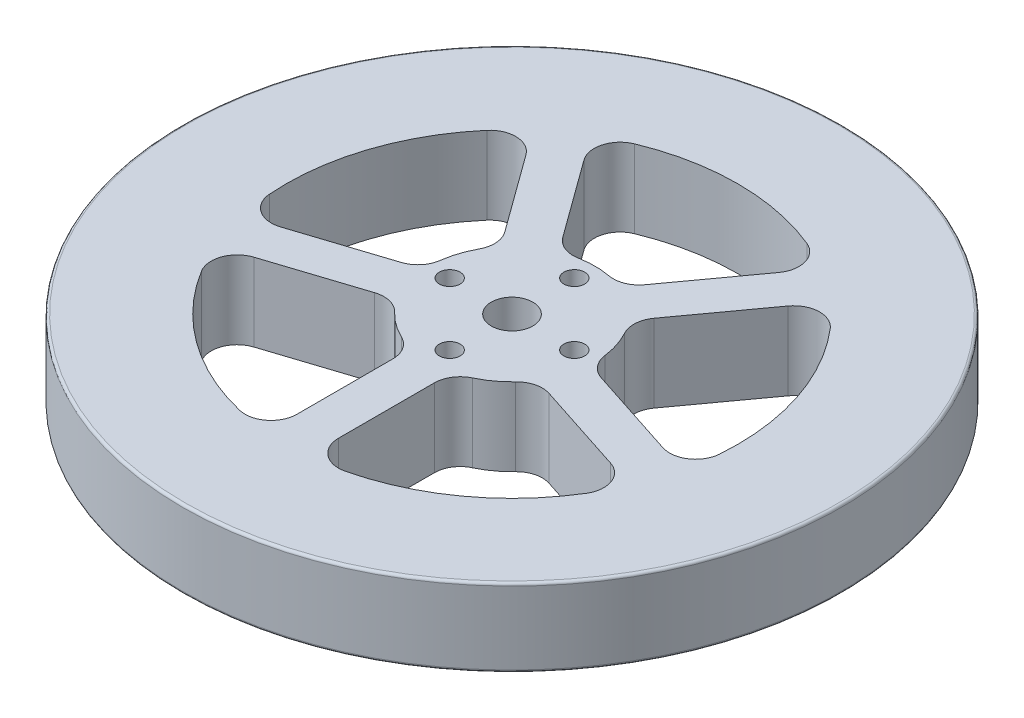
from build123d import *

# Parameters (mm, degrees)
SKETCH2_R           = 63.5
BOSS_EXTRUDE1_DEPTH = 15
FILLET2_R           = 0.5
CUT_EXTRUDE3_REACH  = 93.047
CUT_EXTRUDE4_REACH  = 93.047
SKETCH6_R           = 2
FILLET3_R           = 5
SKETCH6_4_R         = 2
SKETCH6_4_R_2       = 4
CUT_EXTRUDE5_DEPTH  = 92.046691388


with BuildPart() as part:
    # Sketch2 → Boss-Extrude1 (new body)
    with BuildSketch(Plane(origin=(0, 0, 0), x_dir=(1, 0, 0), z_dir=(0, 1, 0))):
        Circle(SKETCH2_R)
    extrude(amount=BOSS_EXTRUDE1_DEPTH)

    # Fillet2
    fillet2_edges = [part.edges().sort_by_distance(p)[0] for p in [
        (-63.5, 15, 0),
        (-63.5, 0, 0),
    ]]
    fillet(fillet2_edges, radius=FILLET2_R)

    # Sketch5 → Cut-Extrude3 (cut, up to next)
    with BuildSketch(Plane.XZ, mode=Mode.PRIVATE) as cut_extrude3_sk1:
        with BuildLine():
            ThreePointArc((-13.497636218, 8.591496757), (-9.404564037, 12.94427191), (-4, 15.491933385))
            Line((-4, 15.491933385), (-4, 43.315701541))
            ThreePointArc((-4, 43.315701541), (-25.568658475, 35.192239255), (-39.959612231, 17.189513965))
            Line((-39.959612231, 17.189513965), (-13.497636218, 8.591496757))
        make_face()
    cut_extrude3_tool1 = extrude(cut_extrude3_sk1.sketch, amount=-CUT_EXTRUDE3_REACH, mode=Mode.PRIVATE) & part.part
    # Sketch5 → Cut-Extrude3 (cut, up to next)
    with BuildSketch(Plane.XZ, mode=Mode.PRIVATE) as cut_extrude3_sk2:
        with BuildLine():
            Line((4, 43.315701541), (4, 15.491933385))
            ThreePointArc((4, 15.491933385), (9.404564037, 12.94427191), (13.497636218, 8.591496757))
            Line((13.497636218, 8.591496757), (39.959612231, 17.189513965))
            ThreePointArc((39.959612231, 17.189513965), (25.568658475, 35.192239255), (4, 43.315701541))
        make_face()
    cut_extrude3_tool2 = extrude(cut_extrude3_sk2.sketch, amount=-CUT_EXTRUDE3_REACH, mode=Mode.PRIVATE) & part.part
    # Sketch5 → Cut-Extrude3 (cut, up to next)
    with BuildSketch(Plane.XZ, mode=Mode.PRIVATE) as cut_extrude3_sk3:
        with BuildLine():
            Line((42.431748186, 9.581061834), (15.969772173, 0.983044626))
            ThreePointArc((15.969772173, 0.983044626), (15.216904261, -4.94427191), (12.341997951, -10.182096375))
            Line((12.341997951, -10.182096375), (28.696398536, -32.691997661))
            ThreePointArc((28.696398536, -32.691997661), (41.370958459, -13.442239255), (42.431748186, 9.581061834))
        make_face()
    cut_extrude3_tool3 = extrude(cut_extrude3_sk3.sketch, amount=-CUT_EXTRUDE3_REACH, mode=Mode.PRIVATE) & part.part
    # Sketch5 → Cut-Extrude3 (cut, up to next)
    with BuildSketch(Plane.XZ, mode=Mode.PRIVATE) as cut_extrude3_sk4:
        with BuildLine():
            Line((22.224262581, -37.394279679), (5.869861996, -14.884378393))
            ThreePointArc((5.869861996, -14.884378393), (0, -16), (-5.869861996, -14.884378393))
            Line((-5.869861996, -14.884378393), (-22.224262581, -37.394279679))
            ThreePointArc((-22.224262581, -37.394279679), (0, -43.5), (22.224262581, -37.394279679))
        make_face()
    cut_extrude3_tool4 = extrude(cut_extrude3_sk4.sketch, amount=-CUT_EXTRUDE3_REACH, mode=Mode.PRIVATE) & part.part
    # Sketch5 → Cut-Extrude3 (cut, up to next)
    with BuildSketch(Plane.XZ, mode=Mode.PRIVATE) as cut_extrude3_sk5:
        with BuildLine():
            Line((-28.696398536, -32.691997661), (-12.341997951, -10.182096375))
            ThreePointArc((-12.341997951, -10.182096375), (-15.216904261, -4.94427191), (-15.969772173, 0.983044626))
            Line((-15.969772173, 0.983044626), (-42.431748186, 9.581061834))
            ThreePointArc((-42.431748186, 9.581061834), (-41.370958459, -13.442239255), (-28.696398536, -32.691997661))
        make_face()
    cut_extrude3_tool5 = extrude(cut_extrude3_sk5.sketch, amount=-CUT_EXTRUDE3_REACH, mode=Mode.PRIVATE) & part.part
    add(cut_extrude3_tool1.solids().sort_by_distance((-18.272678, 0, 25.150183))[0], mode=Mode.SUBTRACT)
    add(cut_extrude3_tool2.solids().sort_by_distance((18.272678, 0, 25.150183))[0], mode=Mode.SUBTRACT)
    add(cut_extrude3_tool3.solids().sort_by_distance((29.565814, 0, -9.606515))[0], mode=Mode.SUBTRACT)
    add(cut_extrude3_tool4.solids().sort_by_distance((0, 0, -31.087336))[0], mode=Mode.SUBTRACT)
    add(cut_extrude3_tool5.solids().sort_by_distance((-29.565814, 0, -9.606515))[0], mode=Mode.SUBTRACT)

    # Sketch6 → Cut-Extrude4 (cut, up to next)
    with BuildSketch(Plane.XZ, mode=Mode.PRIVATE) as cut_extrude4_sk1:
        with Locations((12, 0)):
            Circle(SKETCH6_R)
    cut_extrude4_tool1 = extrude(cut_extrude4_sk1.sketch, amount=-CUT_EXTRUDE4_REACH, mode=Mode.PRIVATE) & part.part
    # Sketch6 → Cut-Extrude4 (cut, up to next)
    with BuildSketch(Plane.XZ, mode=Mode.PRIVATE) as cut_extrude4_sk2:
        with Locations((0, -12)):
            Circle(SKETCH6_R)
    cut_extrude4_tool2 = extrude(cut_extrude4_sk2.sketch, amount=-CUT_EXTRUDE4_REACH, mode=Mode.PRIVATE) & part.part
    # Sketch6 → Cut-Extrude4 (cut, up to next)
    with BuildSketch(Plane.XZ, mode=Mode.PRIVATE) as cut_extrude4_sk3:
        with Locations((-12, 0)):
            Circle(SKETCH6_R)
    cut_extrude4_tool3 = extrude(cut_extrude4_sk3.sketch, amount=-CUT_EXTRUDE4_REACH, mode=Mode.PRIVATE) & part.part
    # Sketch6 → Cut-Extrude4 (cut, up to next)
    with BuildSketch(Plane.XZ, mode=Mode.PRIVATE) as cut_extrude4_sk4:
        with Locations((0, 12)):
            Circle(SKETCH6_R)
    cut_extrude4_tool4 = extrude(cut_extrude4_sk4.sketch, amount=-CUT_EXTRUDE4_REACH, mode=Mode.PRIVATE) & part.part
    add(cut_extrude4_tool1.solids().sort_by_distance((12, 0, 0))[0], mode=Mode.SUBTRACT)
    add(cut_extrude4_tool2.solids().sort_by_distance((0, 0, -12))[0], mode=Mode.SUBTRACT)
    add(cut_extrude4_tool3.solids().sort_by_distance((-12, 0, 0))[0], mode=Mode.SUBTRACT)
    add(cut_extrude4_tool4.solids().sort_by_distance((0, 0, 12))[0], mode=Mode.SUBTRACT)

    # Fillet3
    fillet3_edges = [part.edges().sort_by_distance(p)[0] for p in [
        (13.497636218, 7.5, 8.591496757),
        (4, 7.5, 15.491933385),
        (39.959612231, 7.5, 17.189513965),
        (4, 7.5, 43.315701541),
        (-4, 7.5, 43.315701541),
        (-4, 7.5, 15.491933385),
        (-13.497636218, 7.5, 8.591496757),
        (-39.959612231, 7.5, 17.189513965),
        (-42.431748186, 7.5, 9.581061834),
        (-15.969772173, 7.5, 0.983044626),
        (-12.341997951, 7.5, -10.182096375),
        (-28.696398536, 7.5, -32.691997661),
        (-22.224262581, 7.5, -37.394279679),
        (22.224262581, 7.5, -37.394279679),
        (5.869861996, 7.5, -14.884378393),
        (28.696398536, 7.5, -32.691997661),
        (42.431748186, 7.5, 9.581061834),
        (-5.869861996, 7.5, -14.884378393),
        (12.341997951, 7.5, -10.182096375),
        (15.969772173, 7.5, 0.983044626),
    ]]
    fillet(fillet3_edges, radius=FILLET3_R)

    # Sketch6<4> → Cut-Extrude5 (cut, through all)
    with BuildSketch(Plane.XZ):
        with Locations((12, 0)):
            Circle(SKETCH6_4_R)
        with Locations((0, -12)):
            Circle(SKETCH6_4_R)
        with Locations((-12, 0)):
            Circle(SKETCH6_4_R)
        with Locations((0, 12)):
            Circle(SKETCH6_4_R)
        Circle(SKETCH6_4_R_2)
    extrude(amount=-CUT_EXTRUDE5_DEPTH, mode=Mode.SUBTRACT)


solid = part.part
